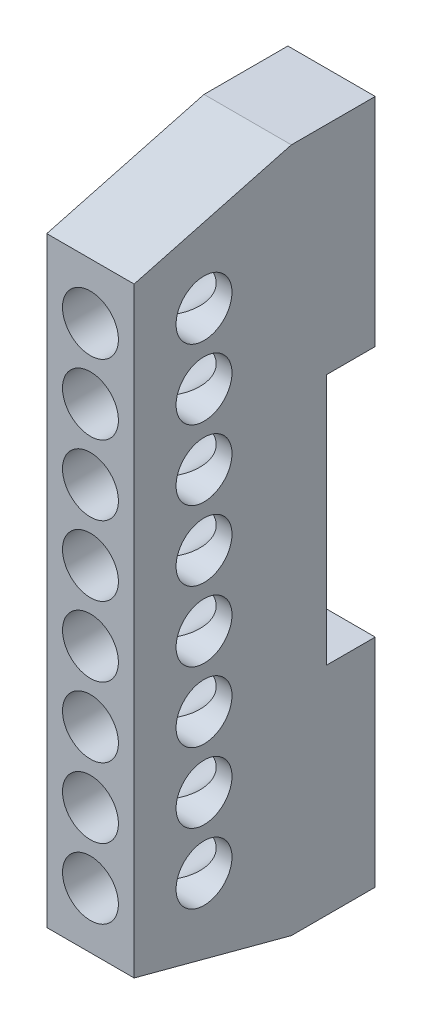
from build123d import *

# Parameters (mm, degrees)
EXTRUDE_1_DEPTH     = 6.25
SKETCH_2_R          = 4
CUT_EXTRUDE_1_DEPTH = 20
SKETCH_3_R          = 4
CUT_EXTRUDE_2_DEPTH = 62.216827752
SKETCH_4_W          = 7
SKETCH_4_H          = 36
CUT_EXTRUDE_3_DEPTH = 62.216827752


with BuildPart() as part:
    # Эскиз1 → Бобышка-Вытянуть1 (new, symmetric)
    with BuildSketch(Plane(origin=(0, 0, 0), x_dir=(0, 0, -1), z_dir=(1, 0, 0))):
        Polygon((0, 49), (0, -49), (-12, -49), (-34.5, -43), (-34.5, 43), (-12, 49), align=None)
    extrude(amount=EXTRUDE_1_DEPTH, both=True)

    # Эскиз2 → Вырез-Вытянуть1 (cut)
    with BuildSketch(Plane.XY.offset(34.5)):
        with Locations((0, -5)):
            Circle(SKETCH_2_R)
        with Locations((0, -15)):
            Circle(SKETCH_2_R)
        with Locations((0, -25)):
            Circle(SKETCH_2_R)
        with Locations(Location((0, 25, 0), (0, 0, 180))):
            Circle(SKETCH_2_R)
        with Locations(Location((0, 15, 0), (0, 0, 180))):
            Circle(SKETCH_2_R)
        with Locations(Location((0, 5, 0), (0, 0, 180))):
            Circle(SKETCH_2_R)
        with Locations((0, -35)):
            Circle(SKETCH_2_R)
        with Locations(Location((0, 35, 0), (0, 0, 180))):
            Circle(SKETCH_2_R)
    extrude(amount=-CUT_EXTRUDE_1_DEPTH, mode=Mode.SUBTRACT)

    # Эскиз3 → Вырез-Вытянуть2 (cut, through all)
    with BuildSketch(Plane(origin=(6.25, 0, 0), x_dir=(0, 0, -1), z_dir=(1, 0, 0))):
        with Locations((-24.5, -35)):
            Circle(SKETCH_3_R)
        with Locations((-24.5, -25)):
            Circle(SKETCH_3_R)
        with Locations((-24.5, -15)):
            Circle(SKETCH_3_R)
        with Locations((-24.5, -5)):
            Circle(SKETCH_3_R)
        with Locations((-24.5, 5)):
            Circle(SKETCH_3_R)
        with Locations((-24.5, 15)):
            Circle(SKETCH_3_R)
        with Locations((-24.5, 25)):
            Circle(SKETCH_3_R)
        with Locations((-24.5, 35)):
            Circle(SKETCH_3_R)
    extrude(amount=-CUT_EXTRUDE_2_DEPTH, mode=Mode.SUBTRACT)

    # Эскиз4 → Вырез-Вытянуть3 (cut, through all)
    with BuildSketch(Plane.ZY.offset(6.25)):
        with Locations((3.5, 0)):
            Rectangle(SKETCH_4_W, SKETCH_4_H)
    extrude(amount=-CUT_EXTRUDE_3_DEPTH, mode=Mode.SUBTRACT)


solid = part.part
